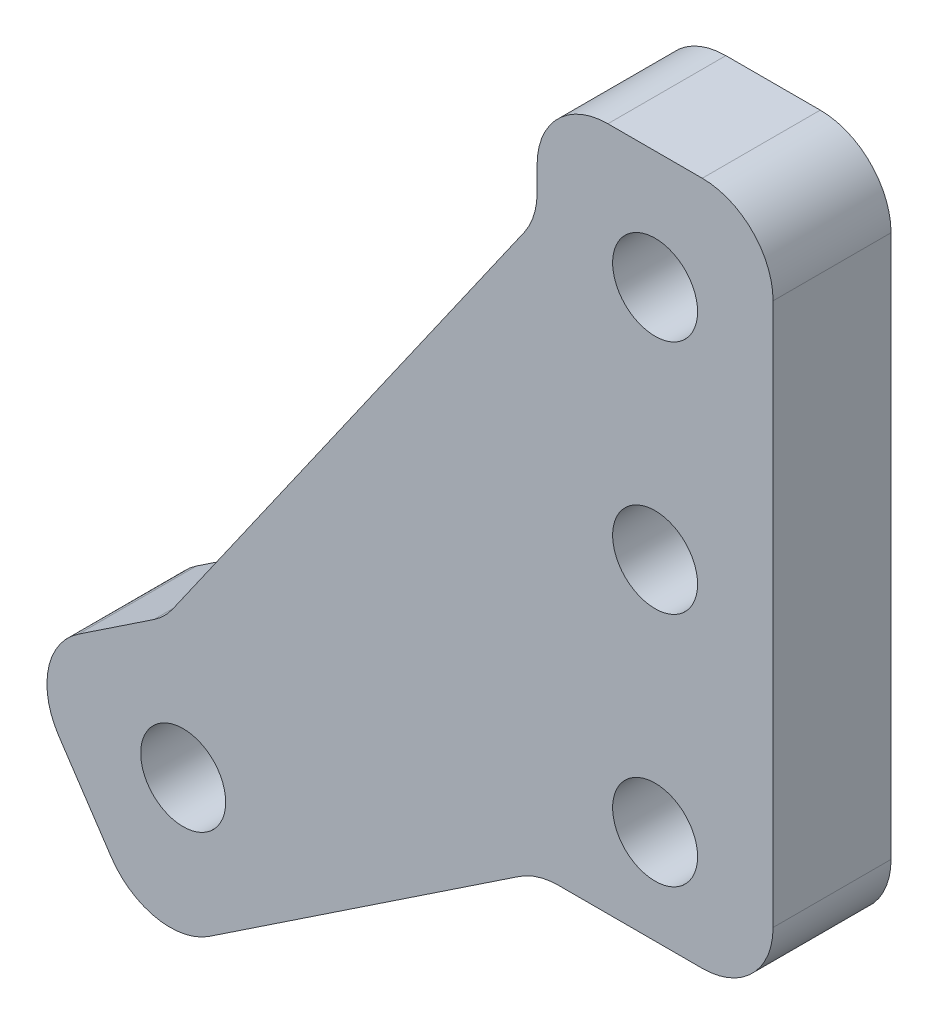
from build123d import *

# Parameters (mm, degrees)
SKETCH1_R           = 2.286
BOSS_EXTRUDE1_DEPTH = 6.35
CHAMFER1_SIZE       = 15.24
CHAMFER1_SIZE2      = 24.085722971
FILLET1_R           = 3.81


with BuildPart() as part:
    # Sketch1 → Boss-Extrude1 (new body)
    with BuildSketch(Plane.XY):
        Polygon((-6.35, 31.75), (-6.35, 10.18883388), (-34.206786825, -8.403439207), (-27.156560793, -18.966786825), (-6.35, -5.08), (6.35, -5.08), (6.35, 31.75), align=None)
        Circle(SKETCH1_R, mode=Mode.SUBTRACT)
        with Locations((0, 25.4)):
            Circle(SKETCH1_R, mode=Mode.SUBTRACT)
        with Locations((-25.4, -10.16)):
            Circle(SKETCH1_R, mode=Mode.SUBTRACT)
        with Locations((0, 12.7)):
            Circle(SKETCH1_R, mode=Mode.SUBTRACT)
    extrude(amount=BOSS_EXTRUDE1_DEPTH)

    # Chamfer1
    chamfer1_edges = [part.edges().sort_by_distance(p)[0] for p in [
        (-6.35, 10.18883388, 3.175),
    ]]
    chamfer1_side = [part.faces().sort_by_distance(p)[0] for p in [
        (-6.35, 20.96941694, 3.175),
    ]]
    chamfer(chamfer1_edges, length=CHAMFER1_SIZE, length2=CHAMFER1_SIZE2, reference=chamfer1_side[0])

    # Fillet1
    fillet1_edges = [part.edges().sort_by_distance(p)[0] for p in [
        (6.35, 31.75, 3.175),
        (6.35, -5.08, 3.175),
        (-6.35, -5.08, 3.175),
        (-27.156560793, -18.966786825, 3.175),
        (-34.206786825, -8.403439207, 3.175),
        (-6.35, 31.75, 3.175),
        (-26.383532628, -3.182015811, 3.175),
        (-6.35, 25.42883388, 3.175),
    ]]
    fillet(fillet1_edges, radius=FILLET1_R)


solid = part.part
